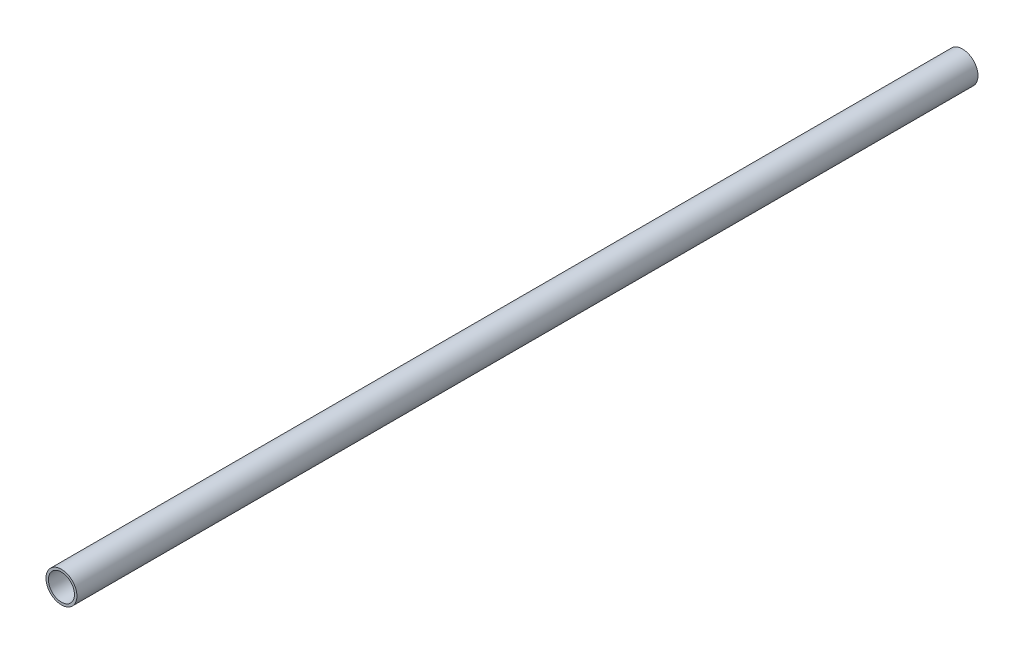
from build123d import *

# Parameters (mm, degrees)
CROQUIS2_R              = 6.35
CROQUIS2_R_2            = 5.35
SALIENTE_EXTRUIR1_DEPTH = 370


with BuildPart() as part:
    # Croquis2 → Saliente-Extruir1 (new body)
    with BuildSketch(Plane.XY):
        Circle(CROQUIS2_R)
        Circle(CROQUIS2_R_2, mode=Mode.SUBTRACT)
    extrude(amount=SALIENTE_EXTRUIR1_DEPTH)


solid = part.part
